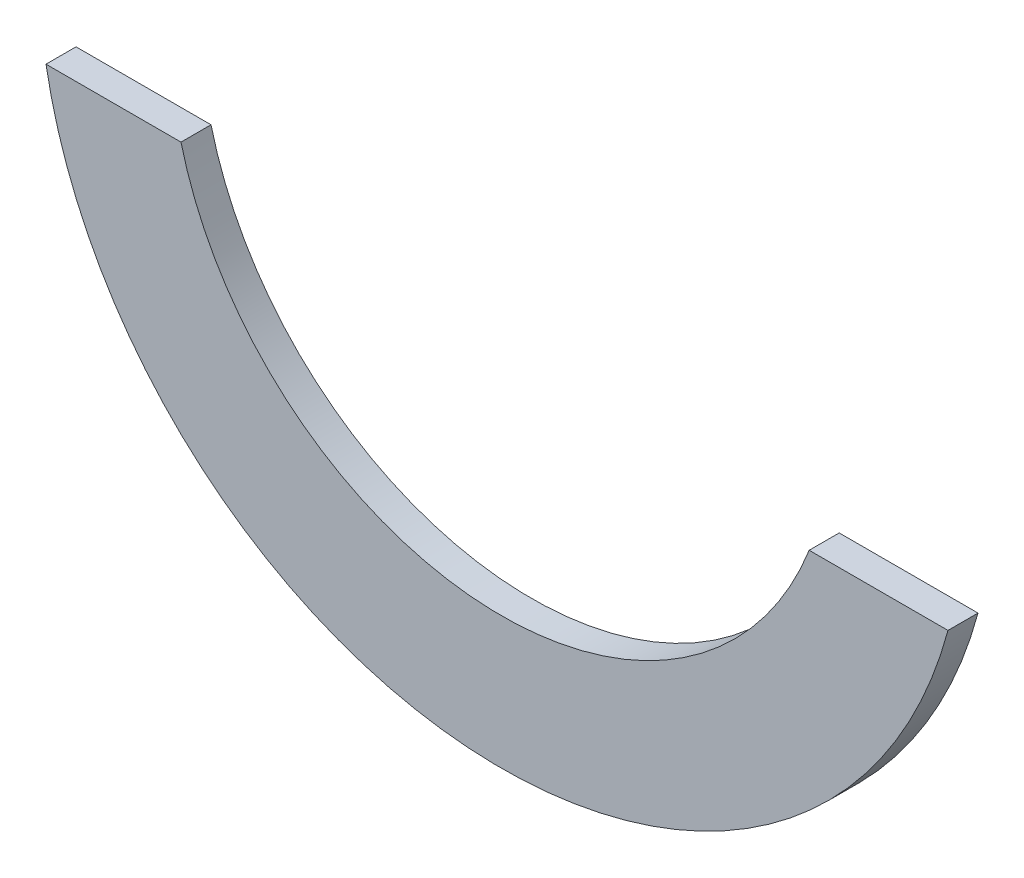
from build123d import *

# Parameters (mm, degrees)
BOSS_EXTRUDE1_DEPTH = 2.5


with BuildPart() as part:
    # Sketch1 → Boss-Extrude1 (new, symmetric)
    with BuildSketch(Plane.XY):
        with BuildLine():
            Line((-75.830196982, -13.37090968), (-53.349965083, -13.37090968))
            ThreePointArc((-53.349965083, -13.37090968), (-3.441199036, -54.892241248), (51.262386889, -19.929066473))
            Line((51.262386889, -19.929066473), (74.376288624, -19.929066473))
            ThreePointArc((74.376288624, -19.929066473), (-3.358692827, -76.926713062), (-75.830196982, -13.37090968))
        make_face()
    extrude(amount=BOSS_EXTRUDE1_DEPTH, both=True)


solid = part.part
